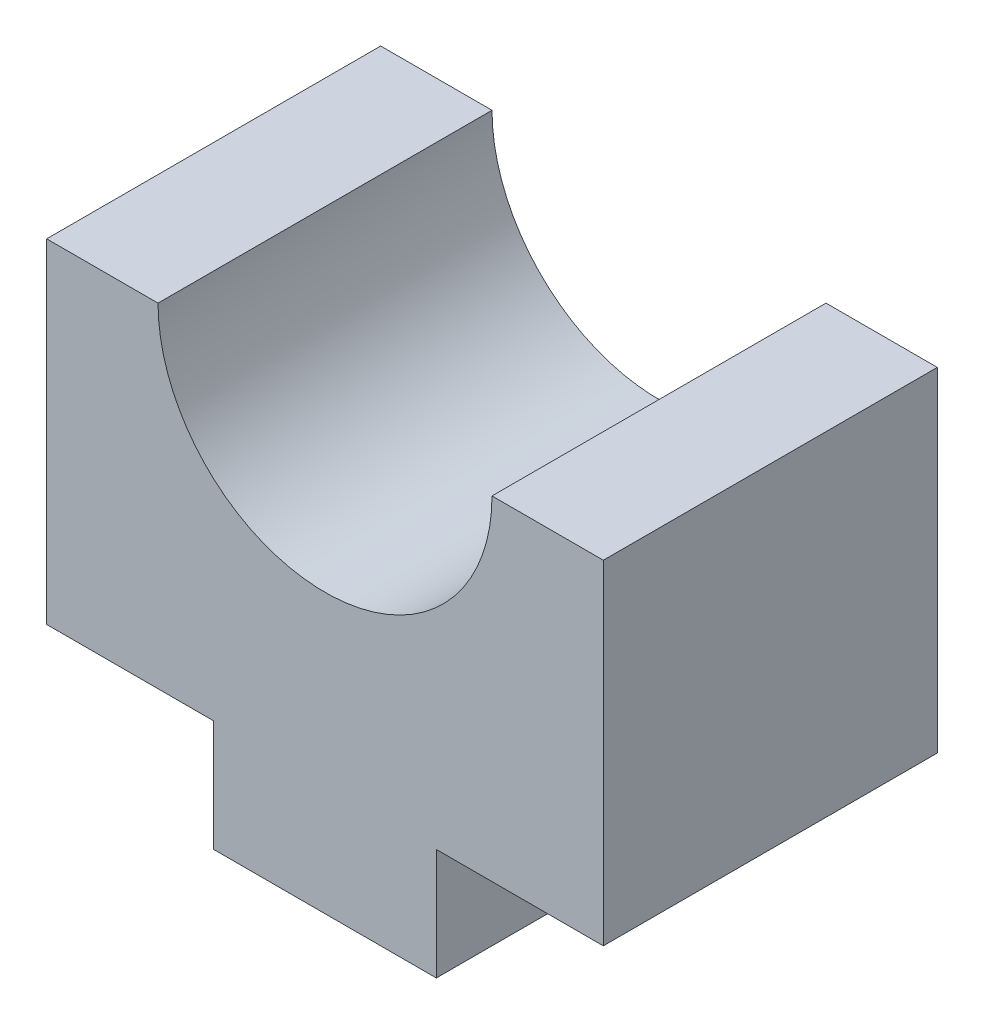
from build123d import *

# Parameters (mm, degrees)
SALIENTE_EXTRUIR1_DEPTH = 15


with BuildPart() as part:
    # Croquis1 → Saliente-Extruir1 (new body)
    with BuildSketch(Plane.XY):
        with BuildLine():
            Line((0, 0), (-10, 0))
            Line((-10, 0), (-10, 5))
            Line((-10, 5), (-17.5, 5))
            Line((-17.5, 5), (-17.5, 20))
            Line((-17.5, 20), (-12.5, 20))
            ThreePointArc((-12.5, 20), (-5, 12.5), (2.5, 20))
            Line((2.5, 20), (7.5, 20))
            Line((7.5, 20), (7.5, 5))
            Line((7.5, 5), (0, 5))
            Line((0, 5), (0, 0))
        make_face()
    extrude(amount=-SALIENTE_EXTRUIR1_DEPTH)


solid = part.part
